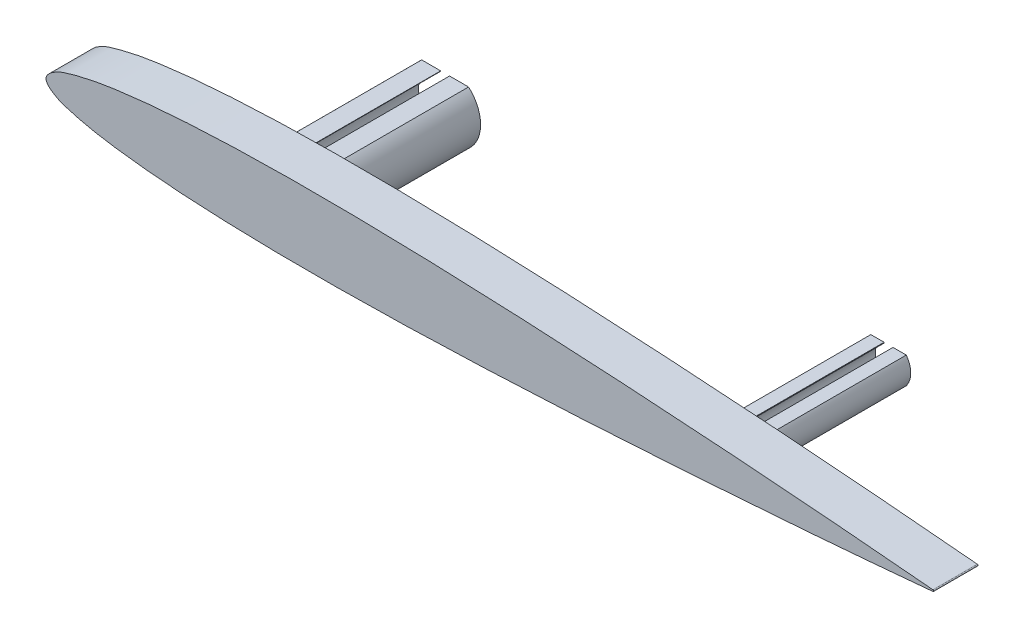
from build123d import *

# Parameters (mm, degrees)
CORPOCENTINA_DEPTH            = 5
AGGANCIOPERNORUDDEVATOR_DEPTH = 15
AGGANCIOLONGHERONE_DEPTH      = 15


with BuildPart() as part:
    # Schizzo1 → CorpoCentina (new body)
    with BuildSketch(Plane.XY):
        with BuildLine():
            ThreePointArc((100, 0.084), (100.084, 0), (100, -0.084))
            add(Edge.make_bspline(
                [(100, 0.084), (98.333488815, 0.23674648), (95.001194725, 0.542172689), (88.335559621, 1.11089898), (80.003293356, 1.763610995), (70.002998933, 2.457861693), (60.003104625, 3.061747723), (50.003008601, 3.552139212), (40.002598558, 3.902946494), (31.666961486, 4.025260151), (24.9991546, 3.976933791), (19.997775587, 3.844976398), (14.993363131, 3.592486959), (10.827184065, 3.237651579), (7.489054388, 2.814021367), (4.99359465, 2.403673059), (2.84962634, 1.867925494), (1.165413503, 1.320987252), (-0.664613784, 0), (1.165413503, -1.320987252), (2.84962634, -1.867925494), (4.99359465, -2.403673059), (7.489054388, -2.814021367), (10.827184065, -3.237651579), (14.993363131, -3.592486959), (19.997775587, -3.844976398), (24.9991546, -3.976933791), (31.666961486, -4.025260151), (40.002598558, -3.902946494), (50.003008601, -3.552139212), (60.003104625, -3.061747723), (70.002998933, -2.457861693), (80.003293356, -1.763610995), (88.335559621, -1.11089898), (95.001194725, -0.542172689), (98.333488815, -0.23674648), (100, -0.084)],
                knots=[0, 0, 0, 0, 0.024876293, 0.049741715, 0.099443402, 0.149112224, 0.198750974, 0.248359097, 0.29793737, 0.347491327, 0.37226694, 0.397050924, 0.421859475, 0.446731346, 0.459220451, 0.471790602, 0.484560454, 0.491195112, 0.5, 0.508804888, 0.515439546, 0.528209398, 0.540779549, 0.553268654, 0.578140525, 0.602949076, 0.62773306, 0.652508673, 0.70206263, 0.751640903, 0.801249026, 0.850887776, 0.900556598, 0.950258285, 0.975123707, 1, 1, 1, 1], degree=3))
        make_face()
    extrude(amount=CORPOCENTINA_DEPTH)

    # Schizzo3 → AggancioPernoRuddevator (add)
    with BuildSketch(Plane(origin=(0, 0, 0), x_dir=(-1, 0, 0), z_dir=(0, 0, -1))):
        with BuildLine():
            Line((-77, 1.5), (-75.5, 1.5))
            Line((-75.5, 1.5), (-75.5, 1.414213562))
            ThreePointArc((-75.5, 1.414213562), (-76.5, 0), (-75.5, -1.414213562))
            Line((-75.5, -1.414213562), (-75.5, -1.5))
            Line((-75.5, -1.5), (-77, -1.5))
            ThreePointArc((-77, -1.5), (-77.5, 0), (-77, 1.5))
        make_face()
        with BuildLine():
            Line((-74.5, 1.5), (-73, 1.5))
            ThreePointArc((-73, 1.5), (-72.5, 0), (-73, -1.5))
            Line((-73, -1.5), (-74.5, -1.5))
            Line((-74.5, -1.5), (-74.5, -1.414213562))
            ThreePointArc((-74.5, -1.414213562), (-73.5, 0), (-74.5, 1.414213562))
            Line((-74.5, 1.414213562), (-74.5, 1.5))
        make_face()
    extrude(amount=AGGANCIOPERNORUDDEVATOR_DEPTH)

    # Schizzo2 → AggancioLongherone (add)
    with BuildSketch(Plane.XY):
        with BuildLine():
            Line((22.354248689, -3), (24.5, -3))
            Line((24.5, -3), (24.5, -2.958039892))
            ThreePointArc((24.5, -2.958039892), (22, 0), (24.5, 2.958039892))
            Line((24.5, 2.958039892), (24.5, 3))
            Line((24.5, 3), (22.354248689, 3))
            ThreePointArc((22.354248689, 3), (21, 0), (22.354248689, -3))
        make_face()
        with BuildLine():
            Line((25.5, -3), (25.5, -2.958039892))
            ThreePointArc((25.5, -2.958039892), (28, 0), (25.5, 2.958039892))
            Line((25.5, 2.958039892), (25.5, 3))
            Line((25.5, 3), (27.645751311, 3))
            ThreePointArc((27.645751311, 3), (29, 0), (27.645751311, -3))
            Line((27.645751311, -3), (25.5, -3))
        make_face()
    extrude(amount=-AGGANCIOLONGHERONE_DEPTH)


solid = part.part
